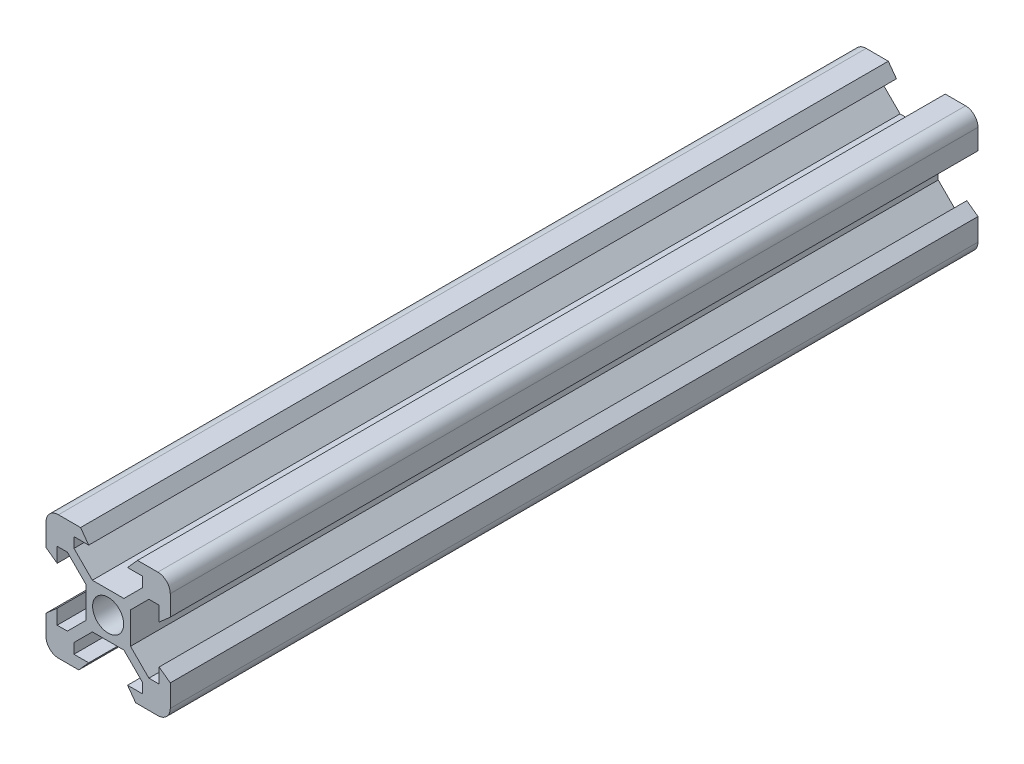
from build123d import *

# Parameters (mm, degrees)
SKETCH1_R               = 2.5
ALUMINIUM_PROFILE_DEPTH = 130


with BuildPart() as part:
    # Sketch1 → Aluminium_profile (new body)
    with BuildSketch(Plane.XY):
        with BuildLine():
            Line((-4.725542729, -10), (-3.125, -8.2))
            Line((-3.125, -8.2), (-5.5, -8.2))
            Line((-5.5, -8.2), (-5.5, -6.560660172))
            Line((-5.5, -6.560660172), (-2.539339828, -3.6))
            Line((-2.539339828, -3.6), (2.539339828, -3.6))
            Line((2.539339828, -3.6), (5.5, -6.560660172))
            Line((5.5, -6.560660172), (5.5, -8.2))
            Line((5.5, -8.2), (3.125, -8.2))
            Line((3.125, -8.2), (4.434457271, -10))
            Line((4.434457271, -10), (8, -10))
            ThreePointArc((8, -10), (9.414213562, -9.414213562), (10, -8))
            Line((10, -8), (10, -4.434457271))
            Line((10, -4.434457271), (8.2, -3.125))
            Line((8.2, -3.125), (8.2, -5.5))
            Line((8.2, -5.5), (6.560660172, -5.5))
            Line((6.560660172, -5.5), (3.6, -2.539339828))
            Line((3.6, -2.539339828), (3.6, 2.539339828))
            Line((3.6, 2.539339828), (6.560660172, 5.5))
            Line((6.560660172, 5.5), (8.2, 5.5))
            Line((8.2, 5.5), (8.2, 3.125))
            Line((8.2, 3.125), (10, 4.725542729))
            Line((10, 4.725542729), (10, 8))
            ThreePointArc((10, 8), (9.414213562, 9.414213562), (8, 10))
            Line((8, 10), (4.725542729, 10))
            Line((4.725542729, 10), (3.125, 8.2))
            Line((3.125, 8.2), (5.5, 8.2))
            Line((5.5, 8.2), (5.5, 6.560660172))
            Line((5.5, 6.560660172), (2.539339828, 3.6))
            Line((2.539339828, 3.6), (-2.539339828, 3.6))
            Line((-2.539339828, 3.6), (-5.5, 6.560660172))
            Line((-5.5, 6.560660172), (-5.5, 8.2))
            Line((-5.5, 8.2), (-3.125, 8.2))
            Line((-3.125, 8.2), (-4.434457271, 10))
            Line((-4.434457271, 10), (-8, 10))
            ThreePointArc((-8, 10), (-9.414213562, 9.414213562), (-10, 8))
            Line((-10, 8), (-10, 4.434457271))
            Line((-10, 4.434457271), (-8.2, 3.125))
            Line((-8.2, 3.125), (-8.2, 5.5))
            Line((-8.2, 5.5), (-6.560660172, 5.5))
            Line((-6.560660172, 5.5), (-3.6, 2.539339828))
            Line((-3.6, 2.539339828), (-3.6, -2.539339828))
            Line((-3.6, -2.539339828), (-6.560660172, -5.5))
            Line((-6.560660172, -5.5), (-8.2, -5.5))
            Line((-8.2, -5.5), (-8.2, -3.125))
            Line((-8.2, -3.125), (-10, -4.725542729))
            Line((-10, -4.725542729), (-10, -8))
            ThreePointArc((-10, -8), (-9.414213562, -9.414213562), (-8, -10))
            Line((-8, -10), (-4.725542729, -10))
        make_face()
        Circle(SKETCH1_R, mode=Mode.SUBTRACT)
    extrude(amount=ALUMINIUM_PROFILE_DEPTH)


solid = part.part
